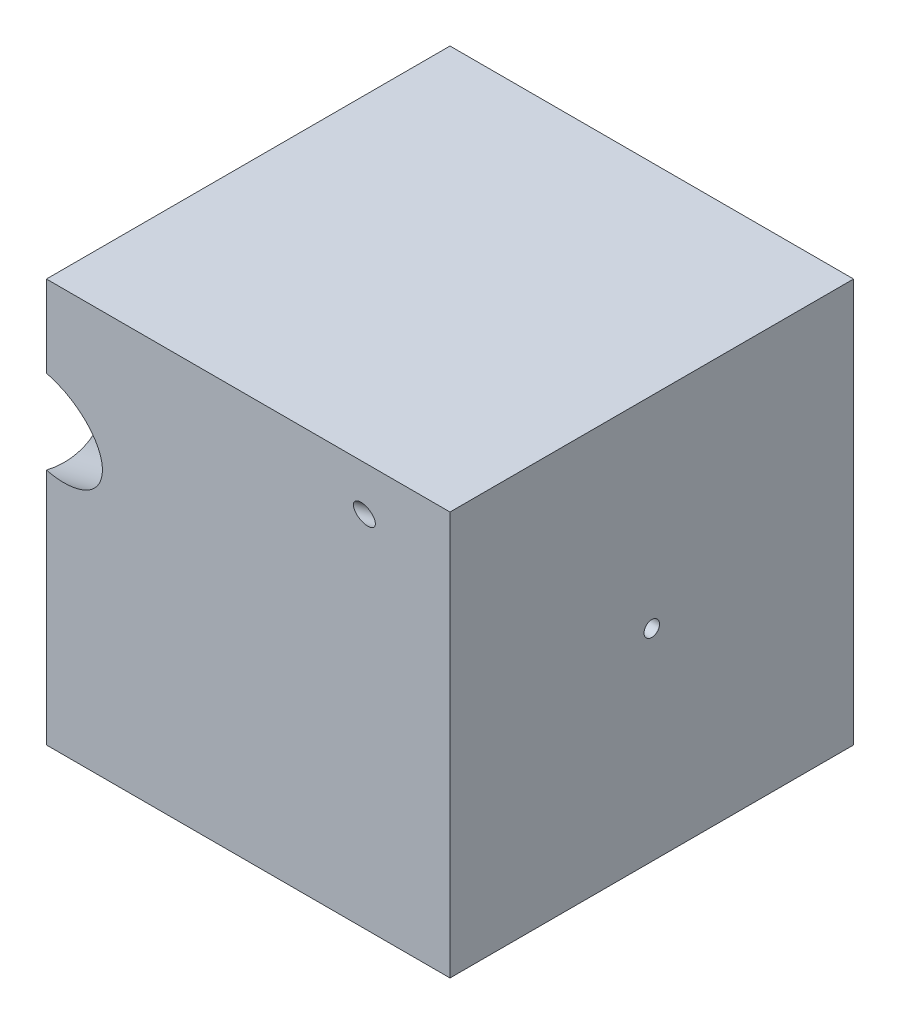
from build123d import *

# Parameters (mm, degrees)
SQUARE_W             = 52
SQUARE_H             = 52
CUBE_EXTRUSION_DEPTH = 52
STICK_CUT_START      = 15
STICK_HOLE_R         = 5.1
STICK_CUT_DEPTH      = 90.048032459
SKETCH1_R            = 1
CUT_EXTRUDE1_DEPTH   = 24
SKETCH2_R            = 1
CUT_EXTRUDE2_DEPTH   = 12
SKETCH6_R            = 1
CUT_EXTRUDE4_DEPTH   = 6
SKETCH7_R            = 1
CUT_EXTRUDE5_DEPTH   = 12
SKETCH8_R            = 1
CUT_EXTRUDE6_DEPTH   = 12
SKETCH11_R           = 1
CUT_EXTRUDE7_DEPTH   = 25


with BuildPart() as part:
    # Square → Cube-Extrusion (new body)
    with BuildSketch(Plane.XY):
        Rectangle(SQUARE_W, SQUARE_H)
    extrude(amount=CUBE_EXTRUSION_DEPTH)

    # Stick-Hole → Stick-Cut (cut, through all)
    with BuildSketch(Plane(origin=(-28.888888889, 14.444444444, 28.888888889), x_dir=(-0.7453559924999299, -0.2981423969999719, -0.596284793999944), z_dir=(0.6666666666666667, -0.3333333333333332, -0.6666666666666667)).offset(STICK_CUT_START)):
        with Locations(Location((-14.635839315, -14.230249471, 0), (0, 0, 18.434948823))):
            Circle(STICK_HOLE_R)
    extrude(amount=-STICK_CUT_DEPTH, mode=Mode.SUBTRACT)

    # Sketch1 → Cut-Extrude1 (cut)
    with BuildSketch(Plane(origin=(-28.888888889, 14.444444444, 28.888888889), x_dir=(-0.7453559924999299, -0.2981423969999719, -0.596284793999944), z_dir=(0.6666666666666667, -0.3333333333333332, -0.6666666666666667))):
        with Locations(Location((-48.193677872, -5.157603573, 0), (0, 0, 36.869897646))):
            Circle(SKETCH1_R)
    extrude(amount=CUT_EXTRUDE1_DEPTH, mode=Mode.SUBTRACT)

    # Sketch2 → Cut-Extrude2 (cut)
    with BuildSketch(Plane.ZY.offset(26)):
        with Locations((5.25, -22)):
            Circle(SKETCH2_R)
    extrude(amount=-CUT_EXTRUDE2_DEPTH, mode=Mode.SUBTRACT)

    # Sketch6 → Cut-Extrude4 (cut, symmetric)
    with BuildSketch(Plane(origin=(-12.68854382, 25.37708764, 0), x_dir=(-0.894427190999916, -0.4472135954999577, 0), z_dir=(0.4472135954999577, -0.894427190999916, 0))):
        with Locations(Location((13.127553483, -6.062116333, 0), (0, 0, 180))):
            Circle(SKETCH6_R)
    extrude(amount=CUT_EXTRUDE4_DEPTH, both=True, mode=Mode.SUBTRACT)

    # Sketch7 → Cut-Extrude5 (cut)
    with BuildSketch(Plane(origin=(26, 0, 0), x_dir=(0, 0, -1), z_dir=(1, 0, 0))):
        with Locations((-26, 0)):
            Circle(SKETCH7_R)
    extrude(amount=-CUT_EXTRUDE5_DEPTH, mode=Mode.SUBTRACT)

    # Sketch8 → Cut-Extrude6 (cut)
    with BuildSketch(Plane(origin=(0, 0, 0), x_dir=(-1, 0, 0), z_dir=(0, 0, -1))):
        Circle(SKETCH8_R)
    extrude(amount=-CUT_EXTRUDE6_DEPTH, mode=Mode.SUBTRACT)

    # Sketch11 → Cut-Extrude7 (cut)
    with BuildSketch(Plane(origin=(-20.663264952, -41.326529904, 20.663264952), x_dir=(0.9128709291752769, -0.3651483716701108, 0.18257418583505525), z_dir=(0.4082482904638631, 0.8164965809277261, -0.4082482904638629))):
        with Locations(Location((22.193323836, -28.912405603, 0), (0, 0, 230.768479516))):
            Circle(SKETCH11_R)
    extrude(amount=CUT_EXTRUDE7_DEPTH, mode=Mode.SUBTRACT)


solid = part.part
